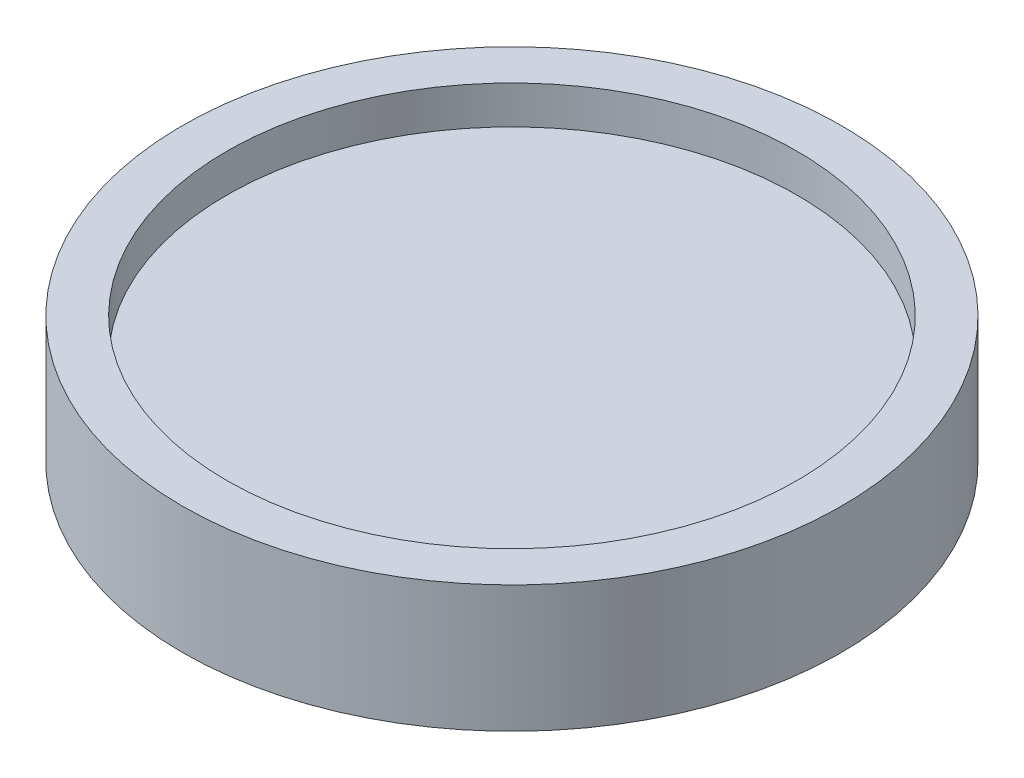
from build123d import *

# Parameters (mm, degrees)
SKETCH1_R           = 33.02
BOSS_EXTRUDE1_DEPTH = 12.7
SKETCH2_R           = 28.575
CUT_EXTRUDE1_DEPTH  = 3.81


with BuildPart() as part:
    # Sketch1 → Boss-Extrude1 (new body)
    with BuildSketch(Plane(origin=(0, 0, 0), x_dir=(1, 0, 0), z_dir=(0, 1, 0))):
        with Locations(Location((0, 0, 0), (0, 0, 270))):
            Circle(SKETCH1_R)
    extrude(amount=BOSS_EXTRUDE1_DEPTH)

    # Sketch2 → Cut-Extrude1 (cut)
    with BuildSketch(Plane(origin=(0, 12.7, 0), x_dir=(1, 0, 0), z_dir=(0, 1, 0))):
        with Locations(Location((0, 0, 0), (0, 0, 270))):
            Circle(SKETCH2_R)
    extrude(amount=-CUT_EXTRUDE1_DEPTH, mode=Mode.SUBTRACT)


solid = part.part
